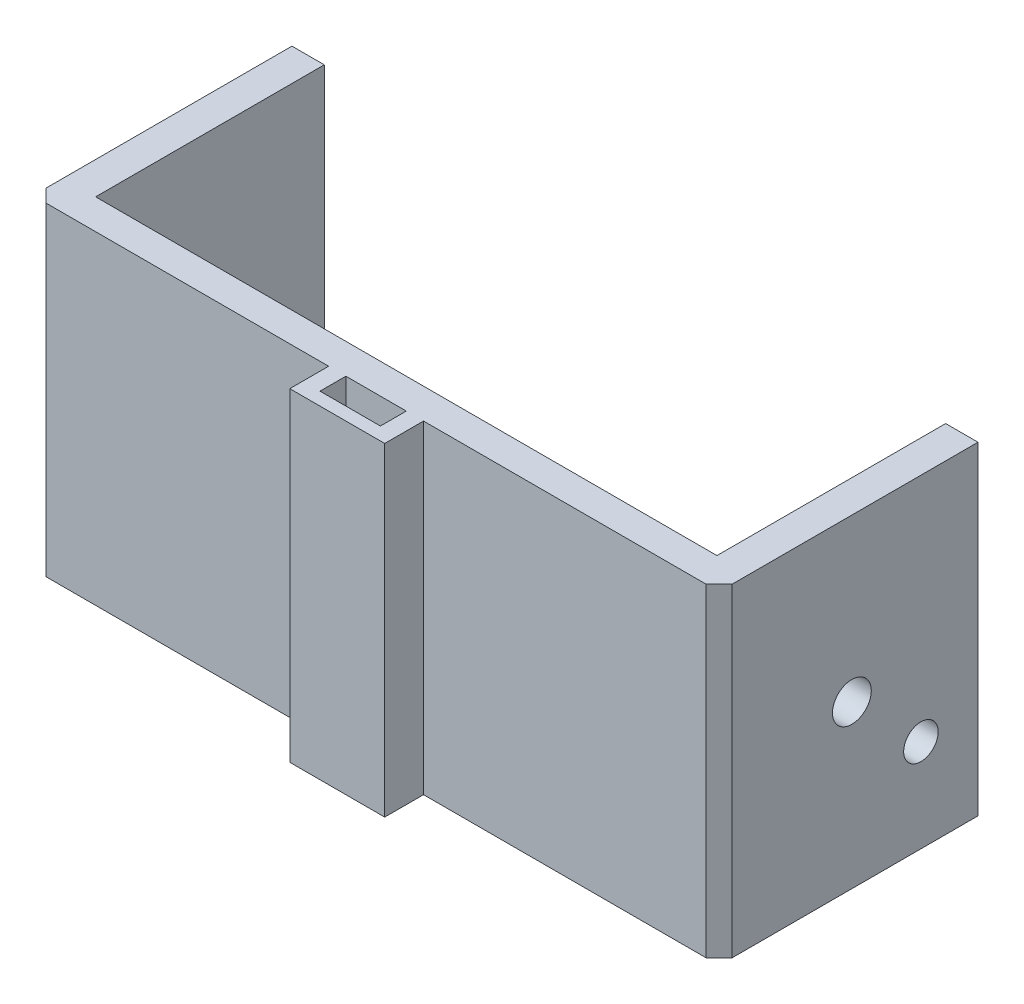
from build123d import *

# Parameters (mm, degrees)
SKETCH1_W               = 14
SKETCH1_H               = 6
BOSS_EXTRUDE1_DEPTH     = 75
SKETCH2_R               = 4.5
CUT_EXTRUDE1_DEPTH      = 16
CUT_EXTRUDE2_DEPTH      = 177.287407378
CUT_EXTRUDE2_DEPTH_BACK = 177.287407378
SKETCH3_R               = 4.5
CHAMFER1_SIZE           = 3
SKETCH4_R               = 4
CUT_EXTRUDE3_DEPTH      = 183.773083357


with BuildPart() as part:
    # Sketch1 → Boss-Extrude1 (new body)
    with BuildSketch(Plane(origin=(0, 0, 0), x_dir=(1, 0, 0), z_dir=(0, 1, 0))):
        Polygon((72, 0), (-72, 0), (-72, 50), (-79.5, 50), (-79.5, -10), (-11, -10), (-11, -19), (11, -19), (11, -10), (79.5, -10), (79.5, 50), (72, 50), align=None)
        with Locations((0, -13)):
            Rectangle(SKETCH1_W, SKETCH1_H, mode=Mode.SUBTRACT)
    extrude(amount=BOSS_EXTRUDE1_DEPTH)

    # Sketch2 → Cut-Extrude1 (cut)
    with BuildSketch(Plane(origin=(0, 0, 0), x_dir=(-1, 0, 0), z_dir=(0, 0, -1))):
        with Locations((0, 37.5)):
            Circle(SKETCH2_R)
    extrude(amount=-CUT_EXTRUDE1_DEPTH, mode=Mode.SUBTRACT)

    # Sketch3 → Cut-Extrude2 (cut, two sides: drawn at the far end of the back side and taken through both)
    with BuildSketch(Plane(origin=(-72, 0, 0), x_dir=(0, 0, -1), z_dir=(1, 0, 0)).offset(-CUT_EXTRUDE2_DEPTH_BACK)):
        with Locations((20.77, 37.5)):
            Circle(SKETCH3_R)
    extrude(amount=CUT_EXTRUDE2_DEPTH + CUT_EXTRUDE2_DEPTH_BACK, mode=Mode.SUBTRACT)

    # Chamfer1
    chamfer1_edges = [part.edges().sort_by_distance(p)[0] for p in [
        (79.5, 37.5, 10),
        (-79.5, 37.5, 10),
        (0, 75, 0),
    ]]
    chamfer(chamfer1_edges, length=CHAMFER1_SIZE)

    # Sketch4 → Cut-Extrude3 (cut, through all)
    with BuildSketch(Plane(origin=(79.5, 0, 0), x_dir=(0, 0, -1), z_dir=(1, 0, 0))):
        with Locations((36.77, 21.5)):
            Circle(SKETCH4_R)
    extrude(amount=-CUT_EXTRUDE3_DEPTH, mode=Mode.SUBTRACT)


solid = part.part
